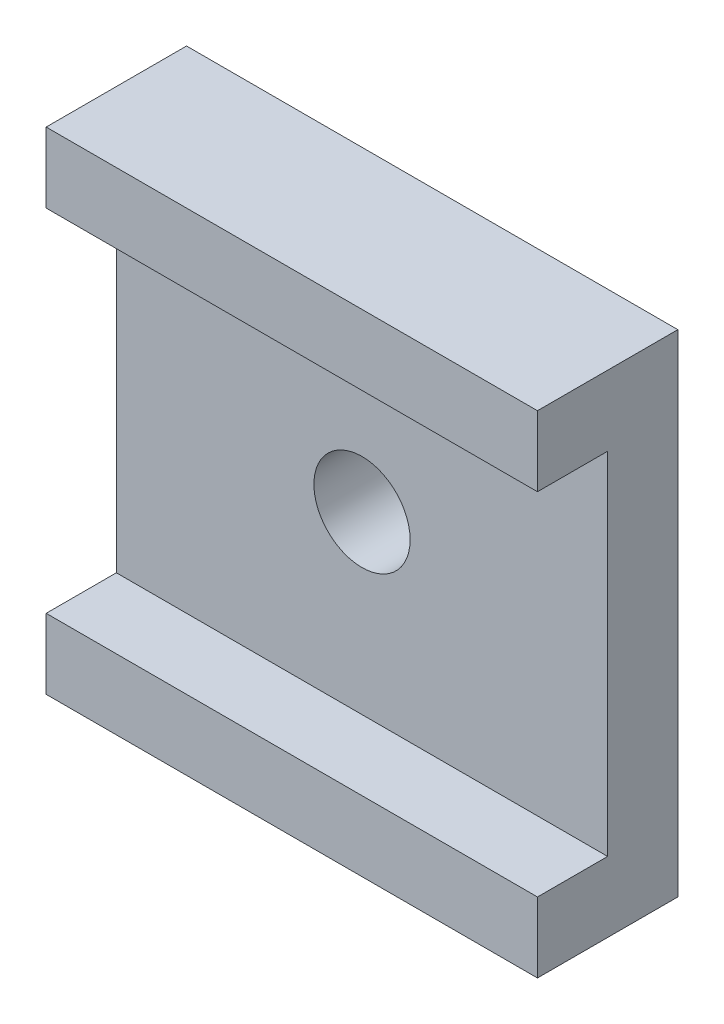
from build123d import *

# Parameters (mm, degrees)
SKETCH1_W           = 70
SKETCH1_H           = 70
BOSS_EXTRUDE1_DEPTH = 20
SKETCH2_W           = 70
SKETCH2_H           = 50
CUT_EXTRUDE1_DEPTH  = 10
SKETCH3_R           = 6.85602035
CUT_EXTRUDE2_DEPTH  = 10


with BuildPart() as part:
    # Sketch1 → Boss-Extrude1 (new body)
    with BuildSketch(Plane.XY):
        with Locations((35, 35)):
            Rectangle(SKETCH1_W, SKETCH1_H)
    extrude(amount=BOSS_EXTRUDE1_DEPTH)

    # Sketch2 → Cut-Extrude1 (cut)
    with BuildSketch(Plane.XY.offset(20)):
        with Locations((35, 35)):
            Rectangle(SKETCH2_W, SKETCH2_H)
    extrude(amount=-CUT_EXTRUDE1_DEPTH, mode=Mode.SUBTRACT)

    # Sketch3 → Cut-Extrude2 (cut)
    with BuildSketch(Plane.XY.offset(10)):
        with Locations((35, 35)):
            Circle(SKETCH3_R)
    extrude(amount=-CUT_EXTRUDE2_DEPTH, mode=Mode.SUBTRACT)


solid = part.part
